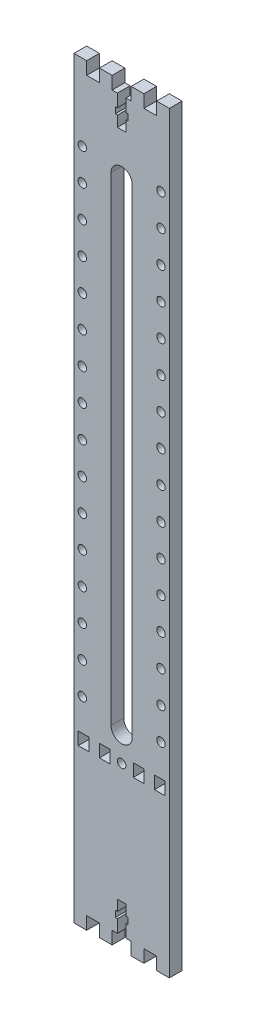
from build123d import *

# Parameters (mm, degrees)
ESQUISSE1_W             = 45
ESQUISSE1_H             = 343.5
ESQUISSE1_R             = 2
ESQUISSE1_W_2           = 5
ESQUISSE1_H_2           = 6
BOSS_EXTRU_1_DEPTH      = 6
ESQUISSE2_W             = 6
ESQUISSE2_H             = 6
BOSS_EXTRU_2_DEPTH      = 6
ENL_V_MAT_EXTRU_1_DEPTH = 351.274892049
ESQUISSE4_R             = 2
ENL_V_MAT_EXTRU_2_DEPTH = 6


with BuildPart() as part:
    # Esquisse1 → Boss.-Extru.1 (new body)
    with BuildSketch(Plane.XY):
        with Locations((0, 171.75)):
            Rectangle(ESQUISSE1_W, ESQUISSE1_H)
        with Locations((0, 70.5)):
            Circle(ESQUISSE1_R, mode=Mode.SUBTRACT)
        with Locations((-18, 70.5)):
            Rectangle(ESQUISSE1_W_2, ESQUISSE1_H_2, mode=Mode.SUBTRACT)
        with Locations((-8, 70.5)):
            Rectangle(ESQUISSE1_W_2, ESQUISSE1_H_2, mode=Mode.SUBTRACT)
        with Locations((8, 70.5)):
            Rectangle(ESQUISSE1_W_2, ESQUISSE1_H_2, mode=Mode.SUBTRACT)
        with Locations((18, 70.5)):
            Rectangle(ESQUISSE1_W_2, ESQUISSE1_H_2, mode=Mode.SUBTRACT)
    extrude(amount=BOSS_EXTRU_1_DEPTH)

    # Esquisse2 → Boss.-Extru.2 (add)
    with BuildSketch(Plane(origin=(0, 343.5, 0), x_dir=(1, 0, 0), z_dir=(0, 1, 0))):
        with Locations((-19.5, -3)):
            Rectangle(ESQUISSE2_W, ESQUISSE2_H)
        with Locations((19.5, -3)):
            Rectangle(ESQUISSE2_W, ESQUISSE2_H)
        with Locations((7.5, -3)):
            Rectangle(ESQUISSE2_W, ESQUISSE2_H)
        with Locations((-7.5, -3)):
            Rectangle(ESQUISSE2_W, ESQUISSE2_H)
    boss_extru_2 = extrude(amount=BOSS_EXTRU_2_DEPTH)

    # Esquisse3 → Enlèv. mat.-Extru.1 (cut, through all)
    with BuildSketch(Plane.XY.offset(6)):
        Polygon((-2, 343.5), (2, 343.5), (2, 337.5), (3, 337.5), (3, 334.5), (2, 334.5), (2, 329.5), (-2, 329.5), (-2, 334.5), (-3, 334.5), (-3, 337.5), (-2, 337.5), align=None)
    enl_v_mat_extru_1 = extrude(amount=-ENL_V_MAT_EXTRU_1_DEPTH, mode=Mode.SUBTRACT)

    # Symétrie1: Boss.-Extru.2, Enlèv. mat.-Extru.1 across plane
    add(boss_extru_2.mirror(Plane.ZX.offset(171.75)))
    add(enl_v_mat_extru_1.mirror(Plane.ZX.offset(171.75)), mode=Mode.SUBTRACT)

    # Esquisse4 → Enlèv. mat.-Extru.2 (cut)
    with BuildSketch(Plane.XY.offset(6)):
        with Locations((-18.575, 88.5)):
            Circle(ESQUISSE4_R)
        with Locations((18.575, 88.5)):
            Circle(ESQUISSE4_R)
        with Locations((-18.575, 103.5)):
            Circle(ESQUISSE4_R)
        with Locations((18.575, 103.5)):
            Circle(ESQUISSE4_R)
        with Locations((-18.575, 118.5)):
            Circle(ESQUISSE4_R)
        with Locations((18.575, 118.5)):
            Circle(ESQUISSE4_R)
        with Locations((-18.575, 133.5)):
            Circle(ESQUISSE4_R)
        with Locations((18.575, 133.5)):
            Circle(ESQUISSE4_R)
        with Locations((-18.575, 148.5)):
            Circle(ESQUISSE4_R)
        with Locations((18.575, 148.5)):
            Circle(ESQUISSE4_R)
        with Locations((-18.575, 163.5)):
            Circle(ESQUISSE4_R)
        with Locations((18.575, 163.5)):
            Circle(ESQUISSE4_R)
        with Locations((-18.575, 178.5)):
            Circle(ESQUISSE4_R)
        with Locations((18.575, 178.5)):
            Circle(ESQUISSE4_R)
        with Locations((-18.575, 193.5)):
            Circle(ESQUISSE4_R)
        with Locations((18.575, 193.5)):
            Circle(ESQUISSE4_R)
        with Locations((-18.575, 208.5)):
            Circle(ESQUISSE4_R)
        with Locations((18.575, 208.5)):
            Circle(ESQUISSE4_R)
        with Locations((-18.575, 223.5)):
            Circle(ESQUISSE4_R)
        with Locations((18.575, 223.5)):
            Circle(ESQUISSE4_R)
        with Locations((-18.575, 238.5)):
            Circle(ESQUISSE4_R)
        with Locations((18.575, 238.5)):
            Circle(ESQUISSE4_R)
        with Locations((-18.575, 253.5)):
            Circle(ESQUISSE4_R)
        with Locations((18.575, 253.5)):
            Circle(ESQUISSE4_R)
        with Locations((-18.575, 268.5)):
            Circle(ESQUISSE4_R)
        with Locations((18.575, 268.5)):
            Circle(ESQUISSE4_R)
        with Locations((-18.575, 283.5)):
            Circle(ESQUISSE4_R)
        with Locations((18.575, 283.5)):
            Circle(ESQUISSE4_R)
        with Locations((-18.575, 298.5)):
            Circle(ESQUISSE4_R)
        with Locations((18.575, 298.5)):
            Circle(ESQUISSE4_R)
        with Locations((-18.575, 313.5)):
            Circle(ESQUISSE4_R)
        with Locations((18.575, 313.5)):
            Circle(ESQUISSE4_R)
        with BuildLine():
            Line((-5, 83.5), (-5, 309.5))
            ThreePointArc((-5, 309.5), (0, 314.5), (5, 309.5))
            Line((5, 309.5), (5, 83.5))
            ThreePointArc((5, 83.5), (0, 78.5), (-5, 83.5))
        make_face()
    extrude(amount=-ENL_V_MAT_EXTRU_2_DEPTH, mode=Mode.SUBTRACT)


solid = part.part
